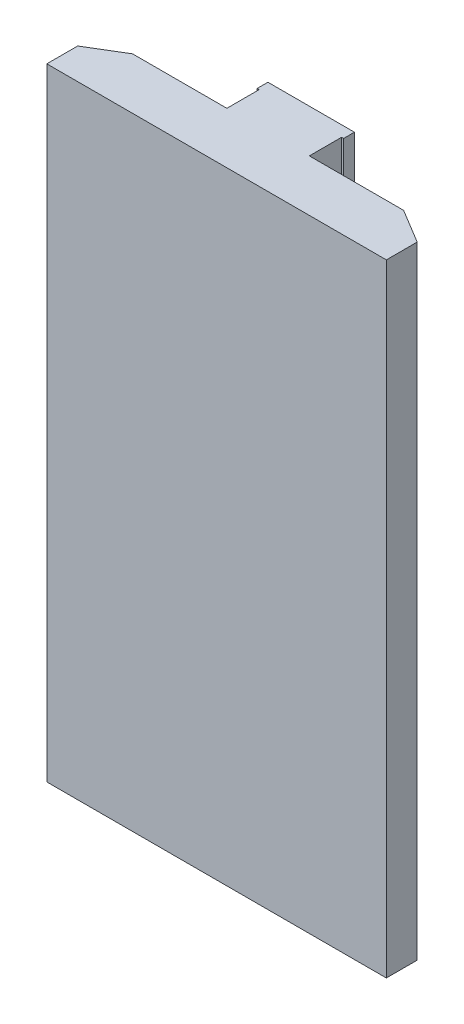
from build123d import *

# Parameters (mm, degrees)
HOUSING_DEPTH            = 302.4
HANGER_HARDWARE_SKETCH_W = 63.43
HANGER_HARDWARE_SKETCH_H = 4.82
HANGER_HARDWARE_DEPTH    = 55


with BuildPart() as part:
    # housing sketch → housing (new, symmetric)
    with BuildSketch(Plane(origin=(0, 0, 0), x_dir=(1, 0, 0), z_dir=(0, 1, 0))):
        Polygon((165.1, 0), (165.1, 30), (131.795345671, 50.1), (40.095, 50.1), (40.095, 81.5), (42.075, 81.5), (42.075, 92), (-42.075, 92), (-42.075, 81.5), (-40.095, 81.5), (-40.095, 50.1), (-131.795345671, 50.1), (-165.1, 30), (-165.1, 0), align=None)
    extrude(amount=HOUSING_DEPTH, both=True)

    # hanger hardware sketch → hanger hardware (add, symmetric)
    with BuildSketch(Plane(origin=(0, 0, 0), x_dir=(1, 0, 0), z_dir=(0, 1, 0))):
        with Locations((0, 93.91)):
            Rectangle(HANGER_HARDWARE_SKETCH_W, HANGER_HARDWARE_SKETCH_H)
    extrude(amount=HANGER_HARDWARE_DEPTH, both=True)


solid = part.part
